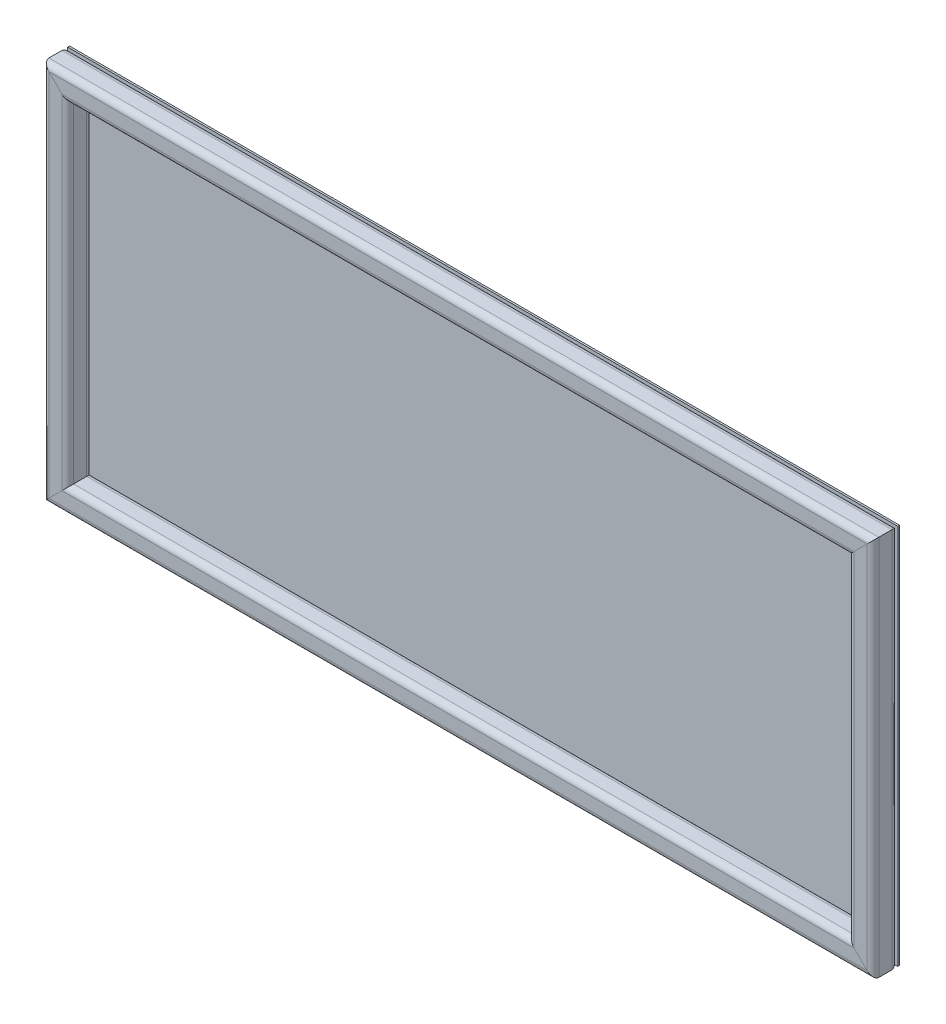
from build123d import *

# Parameters (mm, degrees)
TUBO_CUADRADO_2_X_2_X_0_25_1_DEPTH      = 371.660512242
TUBO_CUADRADO_2_X_2_X_0_25_1_DEPTH_BACK = 31.660512242
TUBO_CUADRADO_2_X_2_X_0_25_1_2_DEPTH    = 863.321024484
TUBO_CUADRADO_2_X_2_X_0_25_1_3_DEPTH    = 403.321024484
TUBO_CUADRADO_2_X_2_X_0_25_1_4_DEPTH    = 863.321024484
CROQUIS4_W                              = 850.8
CROQUIS4_H                              = 390.8
SALIENTE_EXTRUIR2_DEPTH                 = 1.9


with BuildPart() as part:
    # Sketch1 → Tubo cuadrado 2 X 2 X 0.25(1) (new, two sides: drawn at the far end of the back side and taken through both)
    with BuildSketch(Plane(origin=(-412.7, 170, 0), x_dir=(1, 0, 0), z_dir=(0, -1, 0)).offset(-TUBO_CUADRADO_2_X_2_X_0_25_1_DEPTH_BACK)):
        with BuildLine():
            Line((-6.7, -12.7), (6.7, -12.7))
            ThreePointArc((6.7, -12.7), (10.942640687, -10.942640687), (12.7, -6.7))
            Line((12.7, -6.7), (12.7, 6.7))
            ThreePointArc((12.7, 6.7), (10.942640687, 10.942640687), (6.7, 12.7))
            Line((6.7, 12.7), (-6.7, 12.7))
            ThreePointArc((-6.7, 12.7), (-10.942640687, 10.942640687), (-12.7, 6.7))
            Line((-12.7, 6.7), (-12.7, -6.7))
            ThreePointArc((-12.7, -6.7), (-10.942640687, -10.942640687), (-6.7, -12.7))
        make_face()
        with BuildLine():
            Line((-6.7, -9.7), (6.7, -9.7))
            ThreePointArc((6.7, -9.7), (8.821320344, -8.821320344), (9.7, -6.7))
            Line((9.7, -6.7), (9.7, 6.7))
            ThreePointArc((9.7, 6.7), (8.821320344, 8.821320344), (6.7, 9.7))
            Line((6.7, 9.7), (-6.7, 9.7))
            ThreePointArc((-6.7, 9.7), (-8.821320344, 8.821320344), (-9.7, 6.7))
            Line((-9.7, 6.7), (-9.7, -6.7))
            ThreePointArc((-9.7, -6.7), (-8.821320344, -8.821320344), (-6.7, -9.7))
        make_face(mode=Mode.SUBTRACT)
    extrude(amount=TUBO_CUADRADO_2_X_2_X_0_25_1_DEPTH + TUBO_CUADRADO_2_X_2_X_0_25_1_DEPTH_BACK)

    # Tubo cuadrado 2 X 2 X 0.25(1) mitre 1
    split(bisect_by=Plane(origin=(-400, 170, 0), x_dir=(0.707106781, -0.707106781, 0), z_dir=(-0.707106781, -0.707106781, 0)), keep=Keep.TOP)

    # Tubo cuadrado 2 X 2 X 0.25(1) mitre 2
    split(bisect_by=Plane(origin=(-400, -170, 0), x_dir=(-0.707106781, -0.707106781, 0), z_dir=(-0.707106781, 0.707106781, 0)), keep=Keep.TOP)


with BuildPart() as body_2:
    # Sketch1 on segment 2 (carried to segment 2) → Tubo cuadrado 2 X 2 X 0.25_1 2 (new body)
    with BuildSketch(Plane(origin=(-431.660512242, -182.7, 0), x_dir=(0, 1, 0), z_dir=(1, 0, 0))):
        with BuildLine():
            Line((-6.7, -12.7), (6.7, -12.7))
            ThreePointArc((6.7, -12.7), (10.942640687, -10.942640687), (12.7, -6.7))
            Line((12.7, -6.7), (12.7, 6.7))
            ThreePointArc((12.7, 6.7), (10.942640687, 10.942640687), (6.7, 12.7))
            Line((6.7, 12.7), (-6.7, 12.7))
            ThreePointArc((-6.7, 12.7), (-10.942640687, 10.942640687), (-12.7, 6.7))
            Line((-12.7, 6.7), (-12.7, -6.7))
            ThreePointArc((-12.7, -6.7), (-10.942640687, -10.942640687), (-6.7, -12.7))
        make_face()
        with BuildLine():
            Line((-6.7, -9.7), (6.7, -9.7))
            ThreePointArc((6.7, -9.7), (8.821320344, -8.821320344), (9.7, -6.7))
            Line((9.7, -6.7), (9.7, 6.7))
            ThreePointArc((9.7, 6.7), (8.821320344, 8.821320344), (6.7, 9.7))
            Line((6.7, 9.7), (-6.7, 9.7))
            ThreePointArc((-6.7, 9.7), (-8.821320344, 8.821320344), (-9.7, 6.7))
            Line((-9.7, 6.7), (-9.7, -6.7))
            ThreePointArc((-9.7, -6.7), (-8.821320344, -8.821320344), (-6.7, -9.7))
        make_face(mode=Mode.SUBTRACT)
    extrude(amount=TUBO_CUADRADO_2_X_2_X_0_25_1_2_DEPTH)

    # Tubo cuadrado 2 X 2 X 0.25_1 2 mitre 1
    split(bisect_by=Plane(origin=(-400, -170, 0), x_dir=(0.707106781, 0.707106781, 0), z_dir=(0.707106781, -0.707106781, 0)), keep=Keep.TOP)

    # Tubo cuadrado 2 X 2 X 0.25_1 2 mitre 2
    split(bisect_by=Plane(origin=(400, -170, 0), x_dir=(0.707106781, -0.707106781, 0), z_dir=(-0.707106781, -0.707106781, 0)), keep=Keep.TOP)


with BuildPart() as body_3:
    # Sketch1 on segment 3 (carried to segment 3) → Tubo cuadrado 2 X 2 X 0.25_1 3 (new body)
    with BuildSketch(Plane(origin=(412.7, -201.660512242, 0), x_dir=(-1, 0, 0), z_dir=(0, 1, 0))):
        with BuildLine():
            Line((-6.7, -12.7), (6.7, -12.7))
            ThreePointArc((6.7, -12.7), (10.942640687, -10.942640687), (12.7, -6.7))
            Line((12.7, -6.7), (12.7, 6.7))
            ThreePointArc((12.7, 6.7), (10.942640687, 10.942640687), (6.7, 12.7))
            Line((6.7, 12.7), (-6.7, 12.7))
            ThreePointArc((-6.7, 12.7), (-10.942640687, 10.942640687), (-12.7, 6.7))
            Line((-12.7, 6.7), (-12.7, -6.7))
            ThreePointArc((-12.7, -6.7), (-10.942640687, -10.942640687), (-6.7, -12.7))
        make_face()
        with BuildLine():
            Line((-6.7, -9.7), (6.7, -9.7))
            ThreePointArc((6.7, -9.7), (8.821320344, -8.821320344), (9.7, -6.7))
            Line((9.7, -6.7), (9.7, 6.7))
            ThreePointArc((9.7, 6.7), (8.821320344, 8.821320344), (6.7, 9.7))
            Line((6.7, 9.7), (-6.7, 9.7))
            ThreePointArc((-6.7, 9.7), (-8.821320344, 8.821320344), (-9.7, 6.7))
            Line((-9.7, 6.7), (-9.7, -6.7))
            ThreePointArc((-9.7, -6.7), (-8.821320344, -8.821320344), (-6.7, -9.7))
        make_face(mode=Mode.SUBTRACT)
    extrude(amount=TUBO_CUADRADO_2_X_2_X_0_25_1_3_DEPTH)

    # Tubo cuadrado 2 X 2 X 0.25_1 3 mitre 1
    split(bisect_by=Plane(origin=(400, 170, 0), x_dir=(0.707106781, 0.707106781, 0), z_dir=(0.707106781, -0.707106781, 0)), keep=Keep.TOP)

    # Tubo cuadrado 2 X 2 X 0.25_1 3 mitre 2
    split(bisect_by=Plane(origin=(400, -170, 0), x_dir=(-0.707106781, 0.707106781, 0), z_dir=(0.707106781, 0.707106781, 0)), keep=Keep.TOP)


with BuildPart() as body_4:
    # Sketch1 on segment 4 (carried to segment 4) → Tubo cuadrado 2 X 2 X 0.25_1 4 (new body)
    with BuildSketch(Plane(origin=(431.660512242, 182.7, 0), x_dir=(0, -1, 0), z_dir=(-1, 0, 0))):
        with BuildLine():
            Line((-6.7, -12.7), (6.7, -12.7))
            ThreePointArc((6.7, -12.7), (10.942640687, -10.942640687), (12.7, -6.7))
            Line((12.7, -6.7), (12.7, 6.7))
            ThreePointArc((12.7, 6.7), (10.942640687, 10.942640687), (6.7, 12.7))
            Line((6.7, 12.7), (-6.7, 12.7))
            ThreePointArc((-6.7, 12.7), (-10.942640687, 10.942640687), (-12.7, 6.7))
            Line((-12.7, 6.7), (-12.7, -6.7))
            ThreePointArc((-12.7, -6.7), (-10.942640687, -10.942640687), (-6.7, -12.7))
        make_face()
        with BuildLine():
            Line((-6.7, -9.7), (6.7, -9.7))
            ThreePointArc((6.7, -9.7), (8.821320344, -8.821320344), (9.7, -6.7))
            Line((9.7, -6.7), (9.7, 6.7))
            ThreePointArc((9.7, 6.7), (8.821320344, 8.821320344), (6.7, 9.7))
            Line((6.7, 9.7), (-6.7, 9.7))
            ThreePointArc((-6.7, 9.7), (-8.821320344, 8.821320344), (-9.7, 6.7))
            Line((-9.7, 6.7), (-9.7, -6.7))
            ThreePointArc((-9.7, -6.7), (-8.821320344, -8.821320344), (-6.7, -9.7))
        make_face(mode=Mode.SUBTRACT)
    extrude(amount=TUBO_CUADRADO_2_X_2_X_0_25_1_4_DEPTH)

    # Tubo cuadrado 2 X 2 X 0.25_1 4 mitre 1
    split(bisect_by=Plane(origin=(-400, 170, 0), x_dir=(-0.707106781, 0.707106781, 0), z_dir=(0.707106781, 0.707106781, 0)), keep=Keep.TOP)

    # Tubo cuadrado 2 X 2 X 0.25_1 4 mitre 2
    split(bisect_by=Plane(origin=(400, 170, 0), x_dir=(-0.707106781, -0.707106781, 0), z_dir=(-0.707106781, 0.707106781, 0)), keep=Keep.TOP)


with BuildPart() as body_5:
    # Croquis4 → Saliente-Extruir2 (new body)
    with BuildSketch(Plane(origin=(0, 0, -12.7), x_dir=(-1, 0, 0), z_dir=(0, 0, -1))):
        Rectangle(CROQUIS4_W, CROQUIS4_H)
    extrude(amount=SALIENTE_EXTRUIR2_DEPTH)


solid = Compound([part.part, body_2.part, body_3.part, body_4.part, body_5.part])
